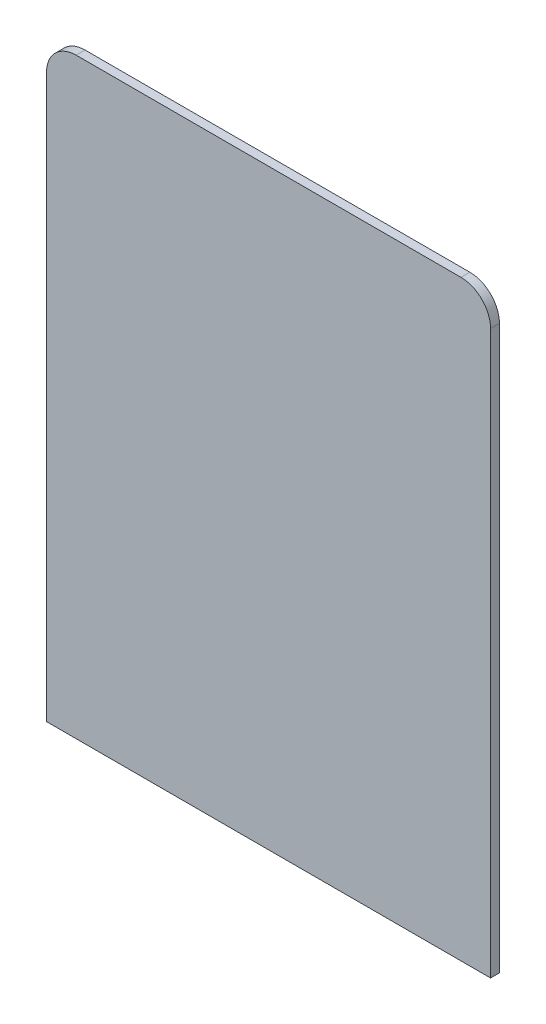
from build123d import *

# Parameters (mm, degrees)
EXTRUDE_1_DEPTH = 1.5


with BuildPart() as part:
    # Эскиз1 → Бобышка-Вытянуть1 (new, symmetric)
    with BuildSketch(Plane.XY):
        with BuildLine():
            Line((-65, 100), (65, 100))
            ThreePointArc((65, 100), (72.071067812, 97.071067812), (75, 90))
            Line((75, 90), (75, -100))
            Line((75, -100), (-75, -100))
            Line((-75, -100), (-75, 90))
            ThreePointArc((-75, 90), (-72.071067812, 97.071067812), (-65, 100))
        make_face()
    extrude(amount=EXTRUDE_1_DEPTH, both=True)


solid = part.part
